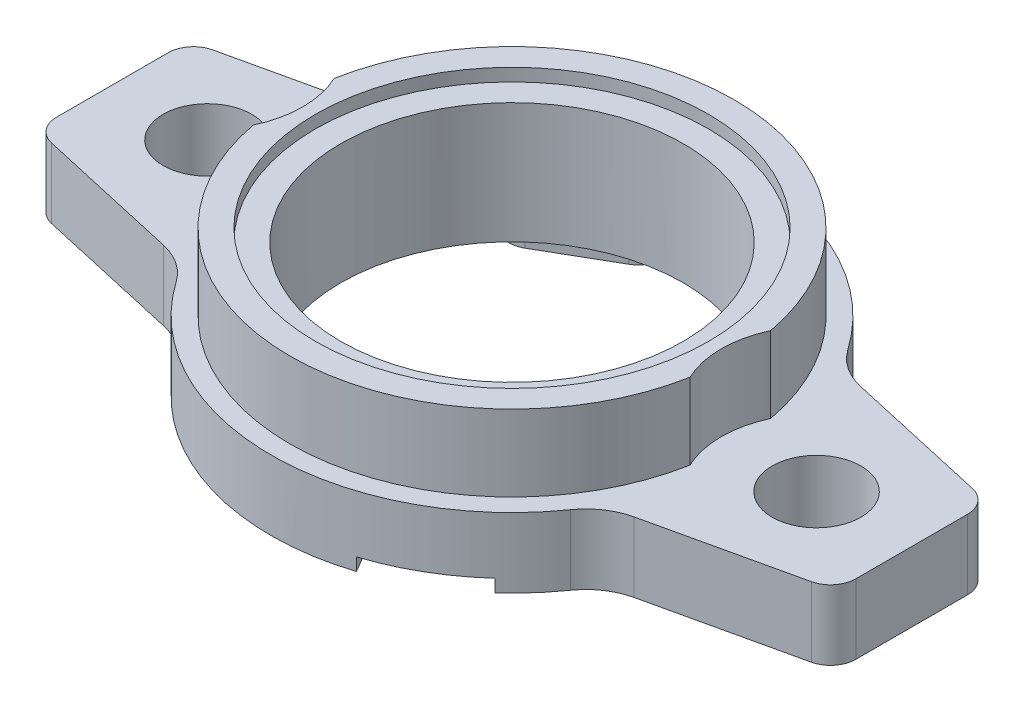
from build123d import *

# Parameters (mm, degrees)
SKETCH_1_R          = 3.5
SKETCH_1_R_2        = 19
EXTRUDE_1_DEPTH     = 11.5
SKETCH_2_R          = 42.113859259
CUT_EXTRUDE_1_DEPTH = 6
SKETCH_3_R          = 15.5
CUT_EXTRUDE_3_DEPTH = 1
CUT_EXTRUDE_4_DEPTH = 1
FILLET_1_R          = 5
SKETCH_5_R          = 13.5
CUT_EXTRUDE_6_DEPTH = 21


with BuildPart() as part:
    # Эскиз1 → Бобышка-Вытянуть1 (new body)
    # profile 1 of 3: a face of its own
    with BuildSketch(Plane(origin=(0, 0, 0), x_dir=(1, 0, 0), z_dir=(0, 1, 0))):
        with BuildLine():
            ThreePointArc((-29.93902439, 6.351219512), (-31.061737619, 5.649390095), (-31.5, 4.4))
            Line((-31.5, 4.4), (-31.5, -4.4))
            ThreePointArc((-31.5, -4.4), (-31.061737619, -5.649390095), (-29.93902439, -6.351219512))
            Line((-29.93902439, -6.351219512), (-16.529826375, -9.368289066))
            ThreePointArc((-16.529826375, -9.368289066), (-19, 0), (-16.529826375, 9.368289066))
            Line((-16.529826375, 9.368289066), (-29.93902439, 6.351219512))
        make_face()
        with Locations(Location((-24, 0, 0), (0, 0, 270))):
            Circle(SKETCH_1_R, mode=Mode.SUBTRACT)
    # profile 2 of 3: a face of its own
    with BuildSketch(Plane(origin=(0, 0, 0), x_dir=(1, 0, 0), z_dir=(0, 1, 0))):
        Circle(SKETCH_1_R_2)
    # profile 3 of 3: a face of its own
    with BuildSketch(Plane(origin=(0, 0, 0), x_dir=(1, 0, 0), z_dir=(0, 1, 0))):
        with BuildLine():
            Line((29.93902439, 6.351219512), (16.529826375, 9.368289066))
            ThreePointArc((16.529826375, 9.368289066), (18.372080736, 4.844238788), (19, 0))
            ThreePointArc((19, 0), (18.372080736, -4.844238788), (16.529826375, -9.368289066))
            Line((16.529826375, -9.368289066), (29.93902439, -6.351219512))
            ThreePointArc((29.93902439, -6.351219512), (31.061737619, -5.649390095), (31.5, -4.4))
            Line((31.5, -4.4), (31.5, 4.4))
            ThreePointArc((31.5, 4.4), (31.061737619, 5.649390095), (29.93902439, 6.351219512))
        make_face()
        with Locations(Location((24, 0, 0), (0, 0, 270))):
            Circle(SKETCH_1_R, mode=Mode.SUBTRACT)
    extrude(amount=EXTRUDE_1_DEPTH)

    # Эскиз2 → Вырез-Вытянуть1 (cut)
    with BuildSketch(Plane(origin=(0, 11.5, 0), x_dir=(1, 0, 0), z_dir=(0, 1, 0))):
        Circle(SKETCH_2_R)
        with BuildLine():
            ThreePointArc((17.208333333, 3.1817077), (0, 17.5), (-17.208333333, 3.1817077))
            ThreePointArc((-17.208333333, 3.1817077), (-16.5, 0), (-17.208333333, -3.1817077))
            ThreePointArc((-17.208333333, -3.1817077), (0, -17.5), (17.208333333, -3.1817077))
            ThreePointArc((17.208333333, -3.1817077), (16.5, 0), (17.208333333, 3.1817077))
        make_face(mode=Mode.SUBTRACT)
    extrude(amount=-CUT_EXTRUDE_1_DEPTH, mode=Mode.SUBTRACT)

    # Эскиз3 → Вырез-Вытянуть3 (cut)
    with BuildSketch(Plane(origin=(0, 11.5, 0), x_dir=(1, 0, 0), z_dir=(0, 1, 0))):
        with Locations(Location((0, 0, 0), (0, 0, 270))):
            Circle(SKETCH_3_R)
    extrude(amount=-CUT_EXTRUDE_3_DEPTH, mode=Mode.SUBTRACT)

    # Эскиз4 → Вырез-Вытянуть4 (cut)
    with BuildSketch(Plane.XZ):
        with BuildLine():
            Line((-20.848643232, -5.321555273), (-15.718229563, -6.475898348))
            ThreePointArc((-15.718229563, -6.475898348), (-14.636214456, -8.647613914), (-13.256050789, -10.643172341))
            ThreePointArc((-13.256050789, -10.643172341), (-12.584964511, -11.011180012), (-11.850214134, -10.796871074))
            ThreePointArc((-11.850214134, -10.796871074), (-10.750830182, -10.362248437), (-9.598076211, -10.624355653))
            Line((-9.598076211, -10.624355653), (-4.401923789, -13.624355653))
            ThreePointArc((-4.401923789, -13.624355653), (-3.598555295, -14.491616268), (-3.425257564, -15.661022017))
            ThreePointArc((-3.425257564, -15.661022017), (-3.243479361, -16.404488978), (-2.58923223, -16.801662908))
            ThreePointArc((-2.58923223, -16.801662908), (8.351526577, -14.807160559), (15.718229563, -6.475898348))
            Line((15.718229563, -6.475898348), (20.848643232, -5.321555273))
            ThreePointArc((20.848643232, -5.321555273), (21.605203579, -4.563390663), (21.242016303, -3.555773605))
            ThreePointArc((21.242016303, -3.555773605), (19.5, 0), (21.242016303, 3.555773605))
            ThreePointArc((21.242016303, 3.555773605), (21.605203579, 4.563390663), (20.848643232, 5.321555273))
            Line((20.848643232, 5.321555273), (15.718229563, 6.475898348))
            ThreePointArc((15.718229563, 6.475898348), (14.636214456, 8.647613914), (13.256050789, 10.643172341))
            ThreePointArc((13.256050789, 10.643172341), (12.584964511, 11.011180012), (11.850214134, 10.796871074))
            ThreePointArc((11.850214134, 10.796871074), (10.750830182, 10.362248437), (9.598076211, 10.624355653))
            Line((9.598076211, 10.624355653), (4.401923789, 13.624355653))
            ThreePointArc((4.401923789, 13.624355653), (3.598555295, 14.491616268), (3.425257564, 15.661022017))
            ThreePointArc((3.425257564, 15.661022017), (3.243479361, 16.404488978), (2.58923223, 16.801662908))
            ThreePointArc((2.58923223, 16.801662908), (-8.351526577, 14.807160559), (-15.718229563, 6.475898348))
            Line((-15.718229563, 6.475898348), (-20.848643232, 5.321555273))
            ThreePointArc((-20.848643232, 5.321555273), (-21.605203579, 4.563390663), (-21.242016303, 3.555773605))
            ThreePointArc((-21.242016303, 3.555773605), (-19.5, 0), (-21.242016303, -3.555773605))
            ThreePointArc((-21.242016303, -3.555773605), (-21.605203579, -4.563390663), (-20.848643232, -5.321555273))
        make_face()
        with BuildLine():
            Line((6.035898385, 18.454482672), (12.964101615, 14.454482672))
            Line((12.964101615, 14.454482672), (11.464101615, 11.856406461))
            ThreePointArc((11.464101615, 11.856406461), (10.856895256, 11.390480634), (10.098076211, 11.490381057))
            Line((10.098076211, 11.490381057), (4.901923789, 14.490381057))
            ThreePointArc((4.901923789, 14.490381057), (4.435997962, 15.097587415), (4.535898385, 15.856406461))
            Line((4.535898385, 15.856406461), (6.035898385, 18.454482672))
        make_face()
        with BuildLine():
            Line((-6.035898385, -18.454482672), (-4.535898385, -15.856406461))
            ThreePointArc((-4.535898385, -15.856406461), (-4.435997962, -15.097587415), (-4.901923789, -14.490381057))
            Line((-4.901923789, -14.490381057), (-10.098076211, -11.490381057))
            ThreePointArc((-10.098076211, -11.490381057), (-10.856895256, -11.390480634), (-11.464101615, -11.856406461))
            Line((-11.464101615, -11.856406461), (-12.964101615, -14.454482672))
            Line((-12.964101615, -14.454482672), (-6.035898385, -18.454482672))
        make_face()
    extrude(amount=-CUT_EXTRUDE_4_DEPTH, mode=Mode.SUBTRACT)

    # Скругление1
    fillet_1_edges = [part.edges().sort_by_distance(p)[0] for p in [
        (-16.529826375, 2.75, -9.368289066),
        (16.529826375, 2.75, -9.368289066),
        (16.529826375, 2.75, 9.368289066),
        (-16.529826375, 2.75, 9.368289066),
    ]]
    fillet(fillet_1_edges, radius=FILLET_1_R)

    # Эскиз5 → Вырез-Вытянуть6 (cut)
    with BuildSketch(Plane(origin=(0, 10.5, 0), x_dir=(1, 0, 0), z_dir=(0, 1, 0))):
        with Locations(Location((0, 0, 0), (0, 0, 270))):
            Circle(SKETCH_5_R)
    extrude(amount=-CUT_EXTRUDE_6_DEPTH, mode=Mode.SUBTRACT)


solid = part.part
